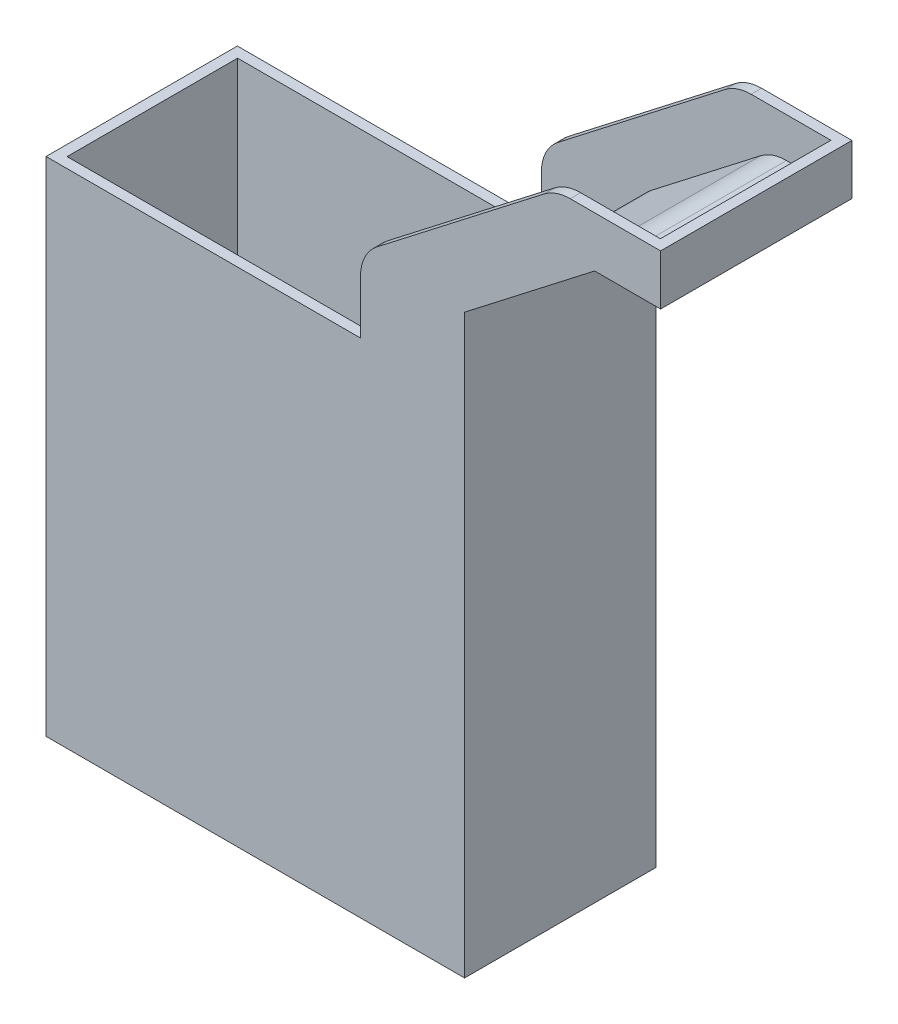
from build123d import *

# Parameters (mm, degrees)
EXTRUDE_1_DEPTH     = 114.3
CUT_EXTRUDE_1_DEPTH = 101.854
FILLET_2_R          = 50.8
FILLET_3_R          = 50.8
FILLET_4_R          = 50.8
FILLET_5_R          = 50.8


with BuildPart() as part:
    # 草图1 → 凸台-拉伸1 (new, symmetric)
    with BuildSketch(Plane.XY):
        Polygon((500, 0), (500, 88.9), (655.436388473, 209.252423204), (734.238570332, 209.252423204), (734.238570332, 269.428634805), (608.842711428, 269.428634805), (375.688128719, 88.9), (375.688128719, 0), (0, 0), (0, -600), (500, -600), align=None)
    extrude(amount=EXTRUDE_1_DEPTH, both=True)

    # 草图2 → 切除-拉伸1 (cut, symmetric)
    with BuildSketch(Plane.XY):
        Polygon((12.7, -12.7), (12.7, 37.178760919), (353.872470169, 37.178760919), (353.872470169, 355.973839439), (721.538570332, 346.822359749), (721.538570332, 256.728634805), (721.538570332, 221.952423204), (651.094376347, 221.952423204), (487.3, 95.128516047), (487.3, -587.3), (12.7, -587.3), align=None)
    extrude(amount=CUT_EXTRUDE_1_DEPTH, both=True, mode=Mode.SUBTRACT)

    # 圆角2
    fillet_2_edges = [part.edges().sort_by_distance(p)[0] for p in [
        (487.3, 95.128516047, 0),
    ]]
    fillet(fillet_2_edges, radius=FILLET_2_R)

    # 圆角3
    fillet_3_edges = [part.edges().sort_by_distance(p)[0] for p in [
        (651.094376347, 221.952423204, 0),
    ]]
    fillet(fillet_3_edges, radius=FILLET_3_R)

    # 圆角4
    fillet_4_edges = [part.edges().sort_by_distance(p)[0] for p in [
        (608.842711428, 269.428634805, 108.077),
        (608.842711428, 269.428634805, -108.077),
    ]]
    fillet(fillet_4_edges, radius=FILLET_4_R)

    # 圆角5
    fillet_5_edges = [part.edges().sort_by_distance(p)[0] for p in [
        (375.688128719, 88.9, 108.077),
        (375.688128719, 88.9, -108.077),
    ]]
    fillet(fillet_5_edges, radius=FILLET_5_R)


solid = part.part
